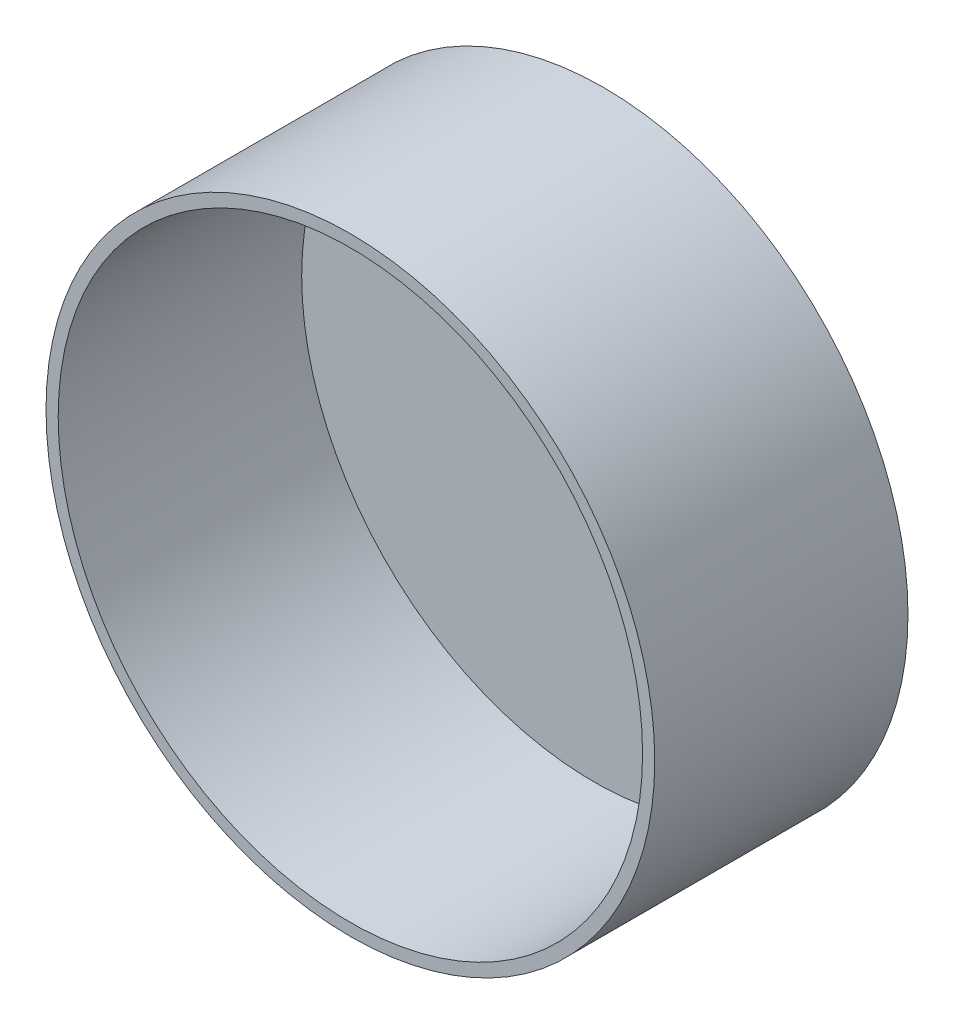
from build123d import *

# Parameters (mm, degrees)
SKETCH1_R           = 125
BOSS_EXTRUDE1_DEPTH = 4
SKETCH2_R           = 125
SKETCH2_R_2         = 120
BOSS_EXTRUDE2_DEPTH = 100


with BuildPart() as part:
    # Sketch1 → Boss-Extrude1 (new body)
    with BuildSketch(Plane.XY):
        Circle(SKETCH1_R)
    extrude(amount=BOSS_EXTRUDE1_DEPTH)

    # Sketch2 → Boss-Extrude2 (add)
    with BuildSketch(Plane.XY.offset(4)):
        Circle(SKETCH2_R)
        Circle(SKETCH2_R_2, mode=Mode.SUBTRACT)
    extrude(amount=BOSS_EXTRUDE2_DEPTH)


solid = part.part
